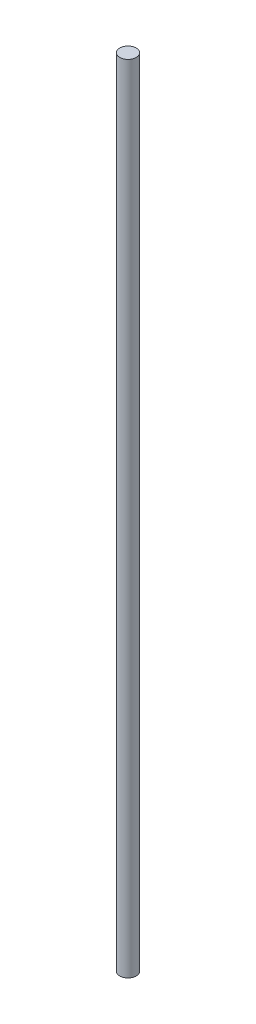
from build123d import *

# Parameters (mm, degrees)
SKETCH1_R           = 4.125
BOSS_EXTRUDE1_DEPTH = 400


with BuildPart() as part:
    # Sketch1 → Boss-Extrude1 (new body)
    with BuildSketch(Plane(origin=(0, 0, 0), x_dir=(1, 0, 0), z_dir=(0, 1, 0))):
        with Locations(Location((0, 0, 0), (0, 0, 270))):
            Circle(SKETCH1_R)
    extrude(amount=BOSS_EXTRUDE1_DEPTH)


solid = part.part
